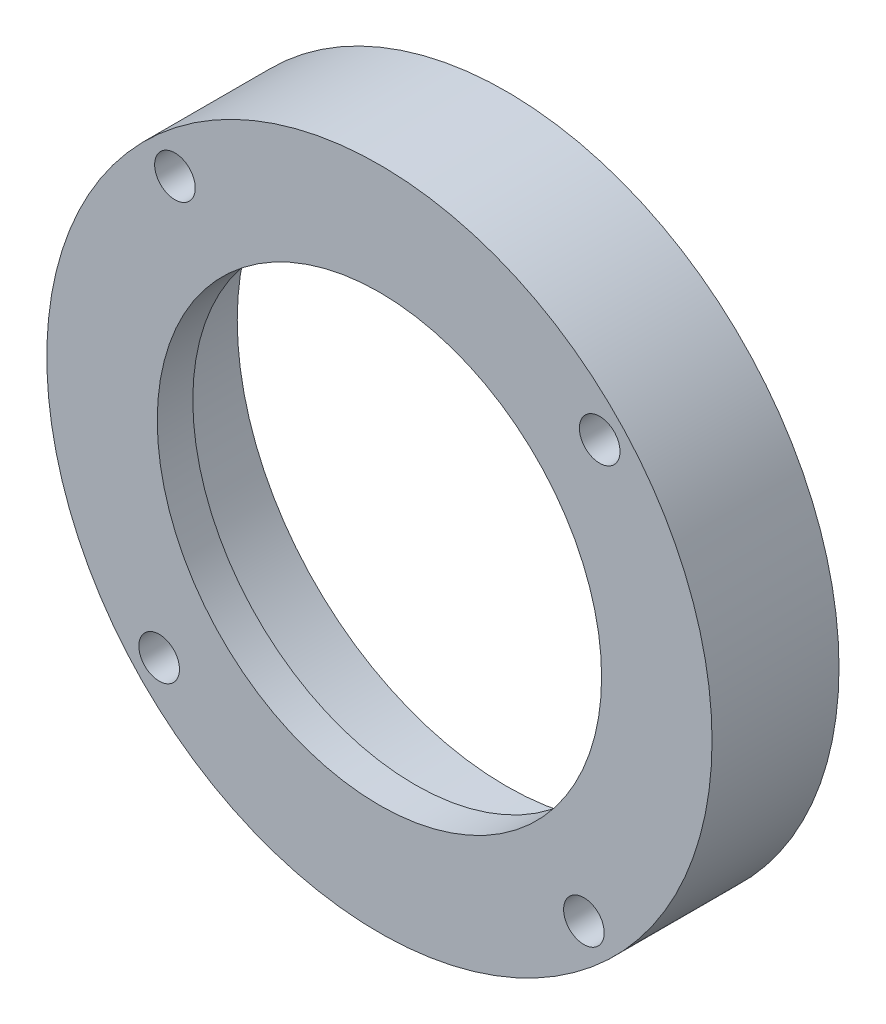
from build123d import *

# Parameters (mm, degrees)
SKETCH1_R           = 26.2
SKETCH1_R_2         = 1.6
SKETCH1_R_3         = 17.5
BOSS_EXTRUDE1_DEPTH = 10
SKETCH2_R           = 21.2
CUT_EXTRUDE1_DEPTH  = 7.2


with BuildPart() as part:
    # Sketch1 → Boss-Extrude1 (new body)
    with BuildSketch(Plane.XY):
        Circle(SKETCH1_R)
        with Locations((17.349171734, 16.10572211)):
            Circle(SKETCH1_R_2, mode=Mode.SUBTRACT)
        with Locations((16.10572211, -17.349171734)):
            Circle(SKETCH1_R_2, mode=Mode.SUBTRACT)
        with Locations((-16.10572211, 17.349171734)):
            Circle(SKETCH1_R_2, mode=Mode.SUBTRACT)
        with Locations((-17.349171734, -16.10572211)):
            Circle(SKETCH1_R_2, mode=Mode.SUBTRACT)
        Circle(SKETCH1_R_3, mode=Mode.SUBTRACT)
    extrude(amount=BOSS_EXTRUDE1_DEPTH)

    # Sketch2 → Cut-Extrude1 (cut)
    with BuildSketch(Plane(origin=(0, 0, 0), x_dir=(-1, 0, 0), z_dir=(0, 0, -1))):
        Circle(SKETCH2_R)
    extrude(amount=-CUT_EXTRUDE1_DEPTH, mode=Mode.SUBTRACT)


solid = part.part
